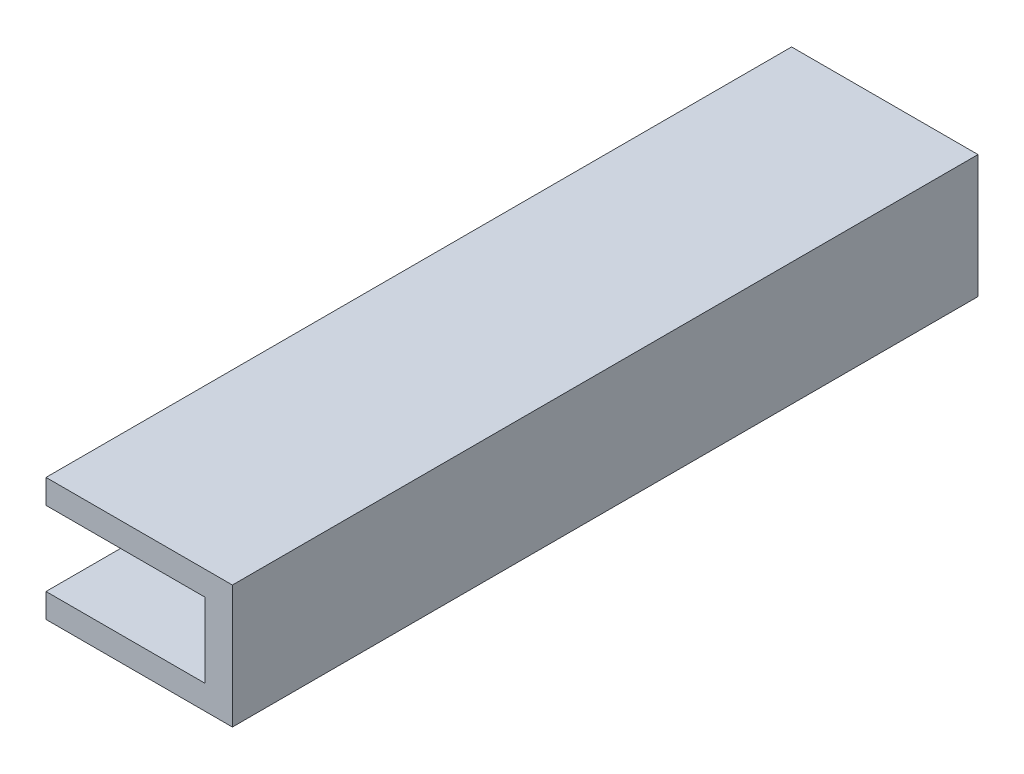
from build123d import *

# Parameters (mm, degrees)
BOSS_EXTRU_1_DEPTH = 200


with BuildPart() as part:
    # Esquisse1 → Boss.-Extru.1 (new body)
    with BuildSketch(Plane.XY):
        Polygon((-50, 26.5), (-7.326688058, 26.5), (-7.326688058, 6.5), (-50, 6.5), (-50, 0), (0, 0), (0, 33), (-50, 33), align=None)
    extrude(amount=BOSS_EXTRU_1_DEPTH)


solid = part.part
